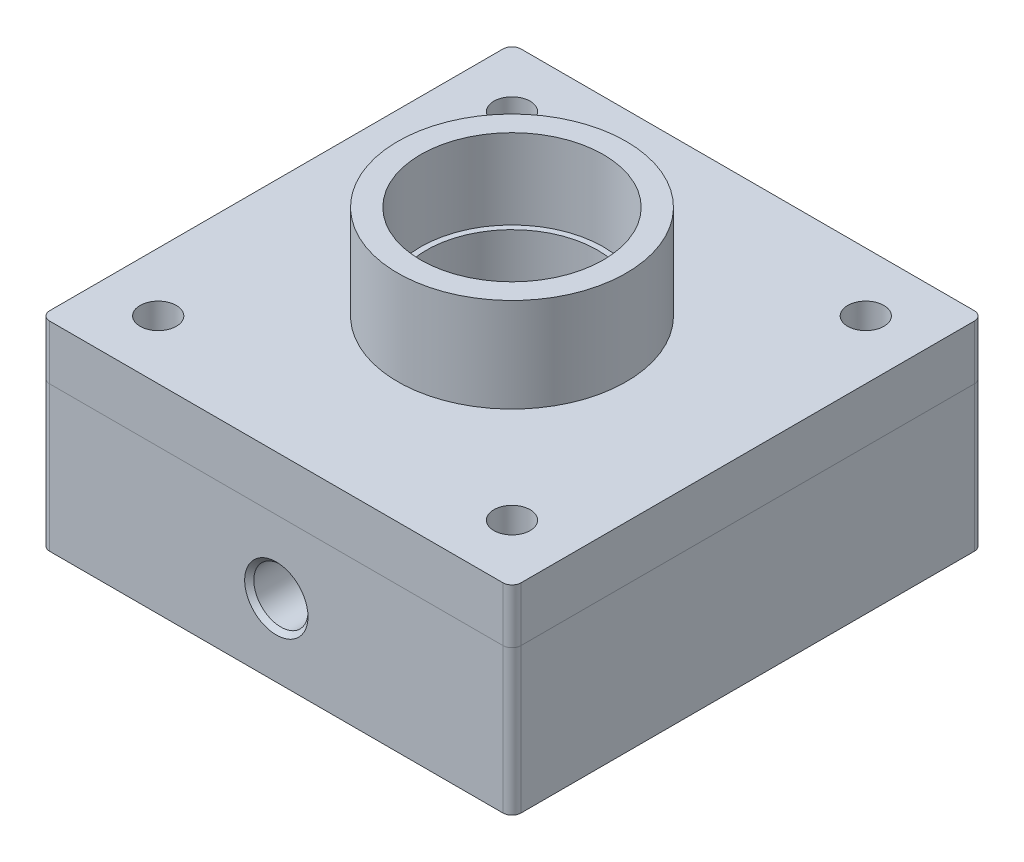
from build123d import *

# Parameters (mm, degrees)
SKETCH1_W                              = 165.1
SKETCH1_H                              = 165.1
BOSS_EXTRUDE1_DEPTH                    = 50.8
SKETCH2_R                              = 40
BOSS_EXTRUDE2_DEPTH                    = 52
SKETCH3_R                              = 32
CUT_EXTRUDE1_DEPTH                     = 28
SKETCH4_R                              = 30
CUT_EXTRUDE2_DEPTH                     = 22
FILLET1_R                              = 3.175
SKETCH5_R                              = 20
CUT_EXTRUDE3_DEPTH                     = 40
SKETCH6_R                              = 76.2
SKETCH6_R_2                            = 69.85
CUT_EXTRUDE4_DEPTH                     = 8
F_1_2_14_NPSM_TAPPED_HOLE1_D           = 18.9738
F_1_2_14_NPSM_TAPPED_HOLE1_DEPTH       = 47.24
F_1_2_14_NPSM_TAPPED_HOLE1_CSINK_D     = 22.1742
F_1_2_14_NPSM_TAPPED_HOLE1_CSINK_ANGLE = 90
F_1_2_14_NPSM_TAPPED_HOLE1_TIP         = 5.700304607
SKETCH10_R                             = 6.35
CUT_EXTRUDE5_DEPTH                     = 25
SKETCH11_R                             = 6.35
CUT_EXTRUDE6_DEPTH                     = 156.553350976
SKETCH12_R                             = 6.35
SKETCH12_R_2                           = 40
BOSS_EXTRUDE3_DEPTH                    = 19.05


with BuildPart() as part:
    # Sketch1 → Boss-Extrude1 (new body)
    with BuildSketch(Plane(origin=(0, 0, 0), x_dir=(1, 0, 0), z_dir=(0, 1, 0))):
        Rectangle(SKETCH1_W, SKETCH1_H)
    extrude(amount=BOSS_EXTRUDE1_DEPTH)

    # Sketch2 → Boss-Extrude2 (add)
    with BuildSketch(Plane(origin=(0, 50.8, 0), x_dir=(1, 0, 0), z_dir=(0, 1, 0))):
        with Locations(Location((0, 0, 0), (0, 0, 90))):
            Circle(SKETCH2_R)
    extrude(amount=BOSS_EXTRUDE2_DEPTH)

    # Sketch3 → Cut-Extrude1 (cut)
    with BuildSketch(Plane(origin=(0, 102.8, 0), x_dir=(1, 0, 0), z_dir=(0, 1, 0))):
        with Locations(Location((0, 0, 0), (0, 0, 270))):
            Circle(SKETCH3_R)
    extrude(amount=-CUT_EXTRUDE1_DEPTH, mode=Mode.SUBTRACT)

    # Sketch4 → Cut-Extrude2 (cut)
    with BuildSketch(Plane(origin=(0, 74.8, 0), x_dir=(1, 0, 0), z_dir=(0, 1, 0))):
        with Locations(Location((0, 0, 0), (0, 0, 270))):
            Circle(SKETCH4_R)
    extrude(amount=-CUT_EXTRUDE2_DEPTH, mode=Mode.SUBTRACT)

    # Fillet1
    fillet1_edges = [part.edges().sort_by_distance(p)[0] for p in [
        (-82.55, 25.4, -82.55),
        (82.55, 25.4, -82.55),
        (82.55, 25.4, 82.55),
        (-82.55, 25.4, 82.55),
    ]]
    fillet(fillet1_edges, radius=FILLET1_R)

    # Sketch5 → Cut-Extrude3 (cut)
    with BuildSketch(Plane.XZ):
        with Locations(Location((0, 0, 0), (0, 0, 270))):
            Circle(SKETCH5_R)
    extrude(amount=-CUT_EXTRUDE3_DEPTH, mode=Mode.SUBTRACT)

    # Sketch6 → Cut-Extrude4 (cut)
    with BuildSketch(Plane.XZ):
        with Locations(Location((0, 0, 0), (0, 0, 270))):
            Circle(SKETCH6_R)
        with Locations(Location((0, 0, 0), (0, 0, 270))):
            Circle(SKETCH6_R_2, mode=Mode.SUBTRACT)
    extrude(amount=-CUT_EXTRUDE4_DEPTH, mode=Mode.SUBTRACT)

    # 1/2-14 NPSM Tapped Hole1
    with Locations(Plane.XY.offset(82.55)):
        with Locations((0, 25.4)):
            CounterSinkHole(F_1_2_14_NPSM_TAPPED_HOLE1_D / 2, F_1_2_14_NPSM_TAPPED_HOLE1_CSINK_D / 2, depth=F_1_2_14_NPSM_TAPPED_HOLE1_DEPTH, counter_sink_angle=F_1_2_14_NPSM_TAPPED_HOLE1_CSINK_ANGLE)
            with Locations((0, 0, -(F_1_2_14_NPSM_TAPPED_HOLE1_DEPTH + F_1_2_14_NPSM_TAPPED_HOLE1_TIP / 2))):  # 118° drill point
                Cone(0, F_1_2_14_NPSM_TAPPED_HOLE1_D / 2, F_1_2_14_NPSM_TAPPED_HOLE1_TIP, mode=Mode.SUBTRACT)

    # Sketch10 → Cut-Extrude5 (cut)
    with BuildSketch(Plane.XZ):
        with Locations(Location((0, 50.55, 0), (0, 0, 270))):
            Circle(SKETCH10_R)
    extrude(amount=-CUT_EXTRUDE5_DEPTH, mode=Mode.SUBTRACT)

    # Sketch11 → Cut-Extrude6 (cut, through all)
    with BuildSketch(Plane.XZ):
        with Locations(Location((-61.963767235, 61.963767235, 0), (0, 0, 270))):
            Circle(SKETCH11_R)
        with Locations(Location((61.963767235, 61.963767235, 0), (0, 0, 270))):
            Circle(SKETCH11_R)
        with Locations(Location((61.963767235, -61.963767235, 0), (0, 0, 270))):
            Circle(SKETCH11_R)
        with Locations(Location((-61.963767235, -61.963767235, 0), (0, 0, 270))):
            Circle(SKETCH11_R)
    extrude(amount=-CUT_EXTRUDE6_DEPTH, mode=Mode.SUBTRACT)


with BuildPart() as body_2:
    # Sketch12 → Boss-Extrude3 (new body)
    with BuildSketch(Plane(origin=(0, 50.8, 0), x_dir=(1, 0, 0), z_dir=(0, 1, 0))):
        with BuildLine():
            Line((79.375, 82.55), (-79.375, 82.55))
            ThreePointArc((-79.375, 82.55), (-81.62006403, 81.62006403), (-82.55, 79.375))
            Line((-82.55, 79.375), (-82.55, -79.375))
            ThreePointArc((-82.55, -79.375), (-81.62006403, -81.62006403), (-79.375, -82.55))
            Line((-79.375, -82.55), (79.375, -82.55))
            ThreePointArc((79.375, -82.55), (81.62006403, -81.62006403), (82.55, -79.375))
            Line((82.55, -79.375), (82.55, 79.375))
            ThreePointArc((82.55, 79.375), (81.62006403, 81.62006403), (79.375, 82.55))
        make_face()
        with Locations(Location((-61.963767235, 61.963767235, 0), (0, 0, 90))):
            Circle(SKETCH12_R, mode=Mode.SUBTRACT)
        with Locations(Location((61.963767235, 61.963767235, 0), (0, 0, 90))):
            Circle(SKETCH12_R, mode=Mode.SUBTRACT)
        with Locations(Location((0, 0, 0), (0, 0, 90))):
            Circle(SKETCH12_R_2, mode=Mode.SUBTRACT)
        with Locations(Location((61.963767235, -61.963767235, 0), (0, 0, 90))):
            Circle(SKETCH12_R, mode=Mode.SUBTRACT)
        with Locations(Location((-61.963767235, -61.963767235, 0), (0, 0, 90))):
            Circle(SKETCH12_R, mode=Mode.SUBTRACT)
    extrude(amount=BOSS_EXTRUDE3_DEPTH)


solid = Compound([part.part, body_2.part])
